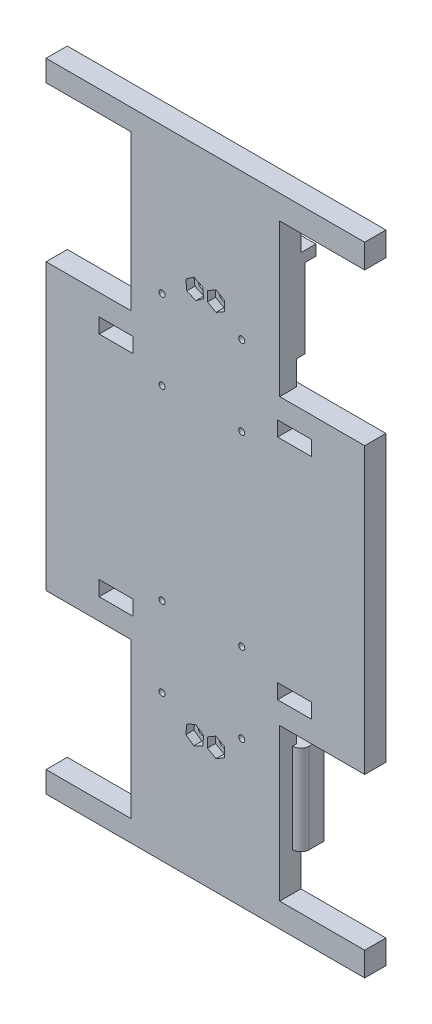
from build123d import *

# Parameters (mm, degrees)
BOSS_EXTRUDE1_DEPTH       = 10
BOSS_EXTRUDE3_DEPTH       = 7
SKETCH4_W                 = 18.8
SKETCH4_H                 = 48.722574615
SKETCH4_H_2               = 48.326634129
BOSS_EXTRUDE4_DEPTH       = 2
CUT_EXTRUDE2_DEPTH        = 9
SKETCH7_R                 = 2.165
CUT_EXTRUDE3_DEPTH        = 336.559234711
CUT_EXTRUDE4_DEPTH        = 3.8
BOSS_EXTRUDE5_DEPTH       = 42.245940515
SKETCH10_W                = 40
SKETCH10_H                = 8.663840555
SKETCH10_H_2              = 10
CUT_EXTRUDE5_DEPTH        = 336.559234711
SKETCH11_W                = 40
SKETCH11_H                = 17.043549312
BOSS_EXTRUDE6_DEPTH       = 10
CUT_EXTRUDE6_REACH        = 337.841
SKETCH12_W                = 16
SKETCH12_H                = 7
F_1_5MM_DOWEL_HOLE1_D     = 2.85
F_1_5MM_DOWEL_HOLE1_DEPTH = 12


with BuildPart() as part:
    # Sketch2 → Boss-Extrude1 (new body)
    with BuildSketch(Plane.XY):
        Polygon((0, 0), (-150, 0), (-150, 20), (-110, 20), (-110, 100), (-150, 100), (-150, 200), (-110, 200), (-110, 280), (-150, 280), (-150, 300), (0, 300), (0, 280), (-40, 280), (-40, 200), (0, 200), (0, 100), (-40, 100), (-40, 20), (0, 20), align=None)
    extrude(amount=BOSS_EXTRUDE1_DEPTH)

    # Sketch3 → Boss-Extrude3 (add)
    with BuildSketch(Plane(origin=(0, 0, 0), x_dir=(-1, 0, 0), z_dir=(0, 0, -1))):
        Polygon((40, 34.233876073), (58.8, 34.233876073), (58.8, 82.956450688), (63.8, 82.956450688), (63.8, 29.233876073), (40, 29.233876073), align=None)
        Polygon((110, 34.629816559), (91.2, 34.629816559), (91.2, 82.956450688), (86.2, 82.956450688), (86.2, 29.233876073), (110, 29.233876073), align=None)
    boss_extrude3 = extrude(amount=BOSS_EXTRUDE3_DEPTH)

    # Sketch4 → Boss-Extrude4 (add)
    with BuildSketch(Plane(origin=(0, 0, 0), x_dir=(-1, 0, 0), z_dir=(0, 0, -1))):
        with Locations((49.4, 58.595163381)):
            Rectangle(SKETCH4_W, SKETCH4_H)
        with Locations((100.6, 58.793133624)):
            Rectangle(SKETCH4_W, SKETCH4_H_2)
    boss_extrude4 = extrude(amount=BOSS_EXTRUDE4_DEPTH)

    # Sketch6 → Cut-Extrude2 (cut)
    with BuildSketch(Plane(origin=(0, 0, -7), x_dir=(-1, 0, 0), z_dir=(0, 0, -1))):
        Polygon((40, 82.956450688), (55.172474276, 82.956450688), (63.8, 82.956450688), (63.8, 71.479816588), (58.8, 71.479816588), (40, 71.479816588), align=None)
        Polygon((91.2, 82.956450688), (110, 82.956450688), (110, 71.479816588), (95.490694749, 71.479816588), (86.2, 71.479816588), (86.2, 82.956450688), align=None)
    cut_extrude2 = extrude(amount=-CUT_EXTRUDE2_DEPTH, mode=Mode.SUBTRACT)

    # Sketch7 → Cut-Extrude3 (cut, through all)
    with BuildSketch(Plane(origin=(0, 0, 0), x_dir=(-1, 0, 0), z_dir=(0, 0, -1))):
        with Locations((70, 59.0298166)):
            Circle(SKETCH7_R)
        with Locations((80, 59.0298166)):
            Circle(SKETCH7_R)
    cut_extrude3 = extrude(amount=-CUT_EXTRUDE3_DEPTH, mode=Mode.SUBTRACT)

    # Sketch8 → Cut-Extrude4 (cut)
    with BuildSketch(Plane.XY.offset(10)):
        Polygon((-83.740057918, 61.707869394), (-84.189290711, 57.129857828), (-80.449232793, 54.451805034), (-76.259942082, 56.351763806), (-75.810709289, 60.929775372), (-79.550767207, 63.607828166), align=None)
        Polygon((-70, 63.6298166), (-73.983716857, 61.3298166), (-73.983716857, 56.7298166), (-70, 54.4298166), (-66.016283143, 56.7298166), (-66.016283143, 61.3298166), align=None)
    cut_extrude4 = extrude(amount=-CUT_EXTRUDE4_DEPTH, mode=Mode.SUBTRACT)

    # Sketch9 → Boss-Extrude5 (add)
    with BuildSketch(Plane.XZ.offset(-29.233876073)):
        with BuildLine():
            Line((-110, -7), (-113.9, -7))
            Line((-113.9, -7), (-113.9, 0))
            ThreePointArc((-113.9, 0), (-112.757716447, 2.757716447), (-110, 3.9))
            Line((-110, 3.9), (-110, 0))
            Line((-110, 0), (-110, -7))
        make_face()
        with BuildLine():
            Line((-40, -7), (-36.1, -7))
            Line((-36.1, -7), (-36.1, 0))
            ThreePointArc((-36.1, 0), (-37.242283553, 2.757716447), (-40, 3.9))
            Line((-40, 3.9), (-40, 0))
            Line((-40, 0), (-40, -7))
        make_face()
    extrude(amount=-BOSS_EXTRUDE5_DEPTH)

    # Mirror2: Boss-Extrude3, Boss-Extrude4, Cut-Extrude2 across plane
    add(boss_extrude3.mirror(Plane.ZX.offset(150)))
    add(boss_extrude4.mirror(Plane.ZX.offset(150)))
    add(cut_extrude2.mirror(Plane.ZX.offset(150)), mode=Mode.SUBTRACT)

    # Mirror3: Cut-Extrude3 across plane
    add(cut_extrude3.mirror(Plane.ZX.offset(150)), mode=Mode.SUBTRACT)

    # Mirror4: Cut-Extrude4 across plane
    add(cut_extrude4.mirror(Plane.ZX.offset(150)), mode=Mode.SUBTRACT)

    # Sketch10 → Cut-Extrude5 (cut, through all)
    with BuildSketch(Plane(origin=(0, 0, 0), x_dir=(-1, 0, 0), z_dir=(0, 0, -1))):
        with Locations((20, 284.331920277)):
            Rectangle(SKETCH10_W, SKETCH10_H)
        with Locations((130, 285)):
            Rectangle(SKETCH10_W, SKETCH10_H_2)
    cut_extrude5 = extrude(amount=-CUT_EXTRUDE5_DEPTH, mode=Mode.SUBTRACT)

    # Mirror5: Cut-Extrude5 across plane
    add(cut_extrude5.mirror(Plane.ZX.offset(150)), mode=Mode.SUBTRACT)

    # Sketch11 → Boss-Extrude6 (add, through all)
    with BuildSketch(Plane(origin=(0, 0, 0), x_dir=(-1, 0, 0), z_dir=(0, 0, -1))):
        with Locations((20, 208.521774656)):
            Rectangle(SKETCH11_W, SKETCH11_H)
        with Locations((130, 208.521774656)):
            Rectangle(SKETCH11_W, SKETCH11_H)
    boss_extrude6 = extrude(amount=-BOSS_EXTRUDE6_DEPTH)

    # Mirror6: Boss-Extrude6 across plane
    add(boss_extrude6.mirror(Plane.ZX.offset(150)))

    # Sketch12 → Cut-Extrude6 (cut, up to next)
    with BuildSketch(Plane.XY.offset(10), mode=Mode.PRIVATE) as cut_extrude6_sk1:
        with Locations((-117, 203.543549312)):
            Rectangle(SKETCH12_W, SKETCH12_H)
    cut_extrude6_tool1 = extrude(cut_extrude6_sk1.sketch, amount=-CUT_EXTRUDE6_REACH, mode=Mode.PRIVATE) & part.part
    # Sketch12 → Cut-Extrude6 (cut, up to next)
    with BuildSketch(Plane.XY.offset(10), mode=Mode.PRIVATE) as cut_extrude6_sk2:
        with Locations((-33, 203.543549312)):
            Rectangle(SKETCH12_W, SKETCH12_H)
    cut_extrude6_tool2 = extrude(cut_extrude6_sk2.sketch, amount=-CUT_EXTRUDE6_REACH, mode=Mode.PRIVATE) & part.part
    # Sketch12 → Cut-Extrude6 (cut, up to next)
    with BuildSketch(Plane.XY.offset(10), mode=Mode.PRIVATE) as cut_extrude6_sk3:
        with Locations((-117, 96.456450688)):
            Rectangle(SKETCH12_W, SKETCH12_H)
    cut_extrude6_tool3 = extrude(cut_extrude6_sk3.sketch, amount=-CUT_EXTRUDE6_REACH, mode=Mode.PRIVATE) & part.part
    # Sketch12 → Cut-Extrude6 (cut, up to next)
    with BuildSketch(Plane.XY.offset(10), mode=Mode.PRIVATE) as cut_extrude6_sk4:
        with Locations((-33, 96.456450688)):
            Rectangle(SKETCH12_W, SKETCH12_H)
    cut_extrude6_tool4 = extrude(cut_extrude6_sk4.sketch, amount=-CUT_EXTRUDE6_REACH, mode=Mode.PRIVATE) & part.part
    add(cut_extrude6_tool1.solids().sort_by_distance((-117, 203.543549, 10))[0], mode=Mode.SUBTRACT)
    add(cut_extrude6_tool2.solids().sort_by_distance((-33, 203.543549, 10))[0], mode=Mode.SUBTRACT)
    add(cut_extrude6_tool3.solids().sort_by_distance((-117, 96.456451, 10))[0], mode=Mode.SUBTRACT)
    add(cut_extrude6_tool4.solids().sort_by_distance((-33, 96.456451, 10))[0], mode=Mode.SUBTRACT)

    # Ø1.5mm Dowel Hole1
    with Locations(Plane.XY.offset(10)):
        with Locations((-57.884566311, 231.352487628), (-95.402442942, 231.352487628), (-95.402442942, 193.834610997), (-57.884566311, 193.834610997), (-95.402442942, 68.647512372), (-57.884566311, 106.165389003), (-57.884566311, 68.647512372), (-95.402442942, 106.165389003)):
            Hole(F_1_5MM_DOWEL_HOLE1_D / 2, depth=F_1_5MM_DOWEL_HOLE1_DEPTH)


solid = part.part
